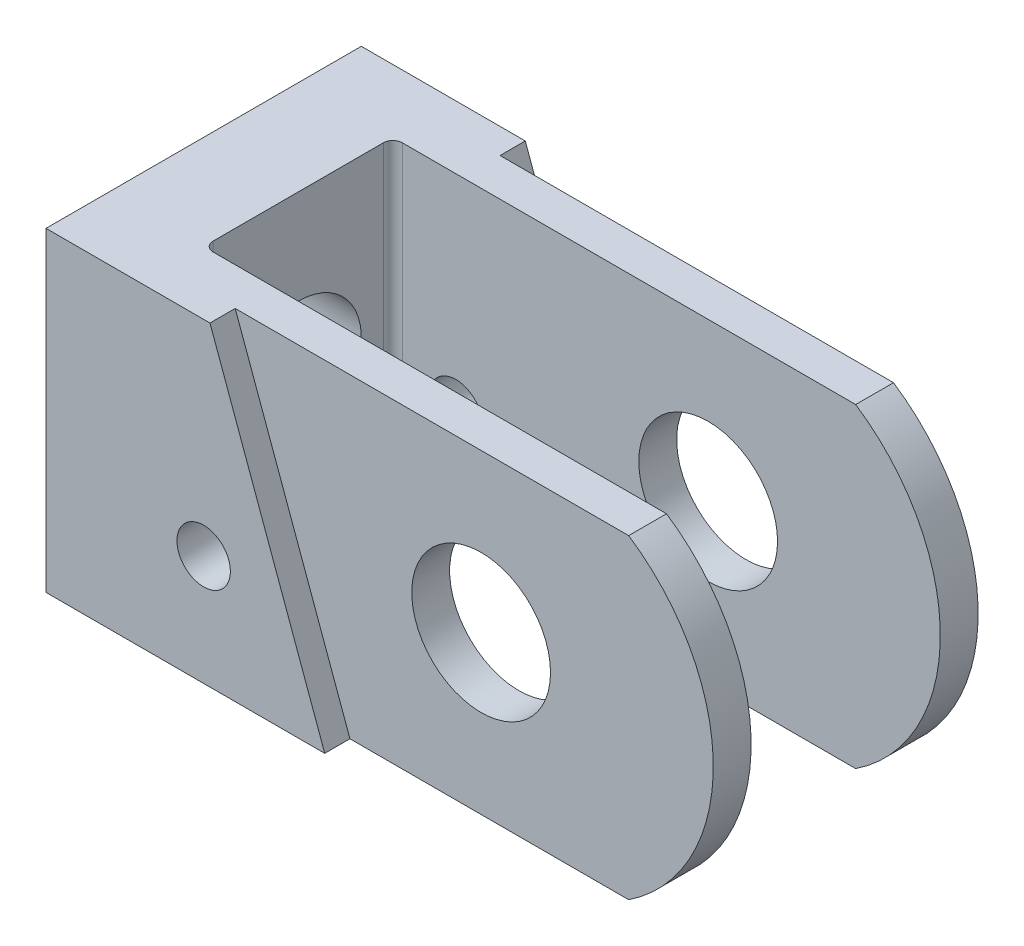
from build123d import *

# Parameters (mm, degrees)
SALIENTE_EXTRUIR1_DEPTH = 50
CROQUIS3_R              = 17.5
CORTAR_EXTRUIR1_DEPTH   = 2
CROQUIS4_R              = 10
CORTAR_EXTRUIR2_DEPTH   = 25
CROQUIS5_R              = 11
CORTAR_EXTRUIR3_DEPTH   = 96.884399238
CORTAR_EXTRUIR4_DEPTH   = 96.884399238
CROQUIS7_R              = 2.5
SALIENTE_EXTRUIR6_DEPTH = 4
CORTAR_EXTRUIR6_DEPTH   = 4
CROQUIS10_R             = 4.23710426
CORTAR_EXTRUIR7_DEPTH   = 98.86632729
SALIENTE_EXTRUIR8_DEPTH = 4
CORTAR_EXTRUIR10_DEPTH  = 4


with BuildPart() as part:
    # Croquis2 → Saliente-Extruir1 (new body)
    with BuildSketch(Plane(origin=(0, 0, 0), x_dir=(1, 0, 0), z_dir=(0, 1, 0))):
        with BuildLine():
            Line((-34.14893617, 19.680851064), (-34.14893617, -30.319148936))
            Line((-34.14893617, -30.319148936), (0, -30.319148936))
            Line((0, -30.319148936), (0, -26.319148936))
            Line((0, -26.319148936), (67.659574468, -26.319148936))
            Line((67.659574468, -26.319148936), (67.659574468, -20.319148936))
            Line((67.659574468, -20.319148936), (-17.64893617, -20.319148936))
            ThreePointArc((-17.64893617, -20.319148936), (-18.709596342, -19.879809108), (-19.14893617, -18.819148936))
            Line((-19.14893617, -18.819148936), (-19.14893617, 8.180851064))
            ThreePointArc((-19.14893617, 8.180851064), (-18.709596342, 9.241511236), (-17.64893617, 9.680851064))
            Line((-17.64893617, 9.680851064), (67.659574468, 9.680851064))
            Line((67.659574468, 9.680851064), (67.659574468, 15.680851064))
            Line((67.659574468, 15.680851064), (0, 15.680851064))
            Line((0, 15.680851064), (0, 19.680851064))
            Line((0, 19.680851064), (-34.14893617, 19.680851064))
        make_face()
    extrude(amount=SALIENTE_EXTRUIR1_DEPTH)

    # Croquis3 → Cortar-Extruir1 (cut)
    with BuildSketch(Plane.ZY.offset(34.14893617)):
        with Locations((5.319148936, 25)):
            Circle(CROQUIS3_R)
    extrude(amount=-CORTAR_EXTRUIR1_DEPTH, mode=Mode.SUBTRACT)

    # Croquis4 → Cortar-Extruir2 (cut)
    with BuildSketch(Plane.ZY.offset(32.14893617)):
        with Locations((5.319148936, 25)):
            Circle(CROQUIS4_R)
    extrude(amount=-CORTAR_EXTRUIR2_DEPTH, mode=Mode.SUBTRACT)

    # Croquis5 → Cortar-Extruir3 (cut, through all)
    with BuildSketch(Plane.XY.offset(26.319148936)):
        with Locations((30.85106383, 25)):
            Circle(CROQUIS5_R)
    extrude(amount=-CORTAR_EXTRUIR3_DEPTH, mode=Mode.SUBTRACT)

    # Croquis6 → Cortar-Extruir4 (cut, through all)
    with BuildSketch(Plane.XY.offset(26.319148936)):
        with BuildLine():
            Line((75.592825188, 50), (75.592825188, 0))
            Line((75.592825188, 0), (54.24269842, 0))
            ThreePointArc((54.24269842, 0), (67.659574468, 25), (54.24269842, 50))
            Line((54.24269842, 50), (75.592825188, 50))
        make_face()
    extrude(amount=-CORTAR_EXTRUIR4_DEPTH, mode=Mode.SUBTRACT)

    # Croquis7 → Saliente-Extruir6 (add)
    with BuildSketch(Plane.XY.offset(30.319148936)):
        Polygon((-34.14893617, 50), (-8.14893617, 50), (10.049575543, 0), (-34.14893617, 0), align=None)
        with Locations((-9.14893617, 17.5)):
            Circle(CROQUIS7_R, mode=Mode.SUBTRACT)
    extrude(amount=-SALIENTE_EXTRUIR6_DEPTH)

    # Croquis8 → Cortar-Extruir6 (cut)
    with BuildSketch(Plane.XY.offset(30.319148936)):
        Polygon((0, 27.61098188), (-8.14893617, 50), (0, 50), align=None)
    extrude(amount=-CORTAR_EXTRUIR6_DEPTH, mode=Mode.SUBTRACT)

    # Croquis10 → Cortar-Extruir7 (cut, through all)
    with BuildSketch(Plane.XY.offset(30.319148936)):
        with Locations((-9.14893617, 17.5)):
            Circle(CROQUIS10_R)
    extrude(amount=-CORTAR_EXTRUIR7_DEPTH, mode=Mode.SUBTRACT)

    # Croquis11 → Saliente-Extruir8 (add)
    with BuildSketch(Plane(origin=(0, 0, -19.680851064), x_dir=(-1, 0, 0), z_dir=(0, 0, -1))):
        Polygon((8.14893617, 50), (-10.049575543, 0), (19.14893617, 0), (19.14893617, 50), align=None)
    extrude(amount=-SALIENTE_EXTRUIR8_DEPTH)

    # Croquis13 → Cortar-Extruir10 (cut)
    with BuildSketch(Plane(origin=(0, 0, -19.680851064), x_dir=(-1, 0, 0), z_dir=(0, 0, -1))):
        Polygon((0, 50), (0, 27.61098188), (8.14893617, 50), align=None)
    extrude(amount=-CORTAR_EXTRUIR10_DEPTH, mode=Mode.SUBTRACT)


solid = part.part
